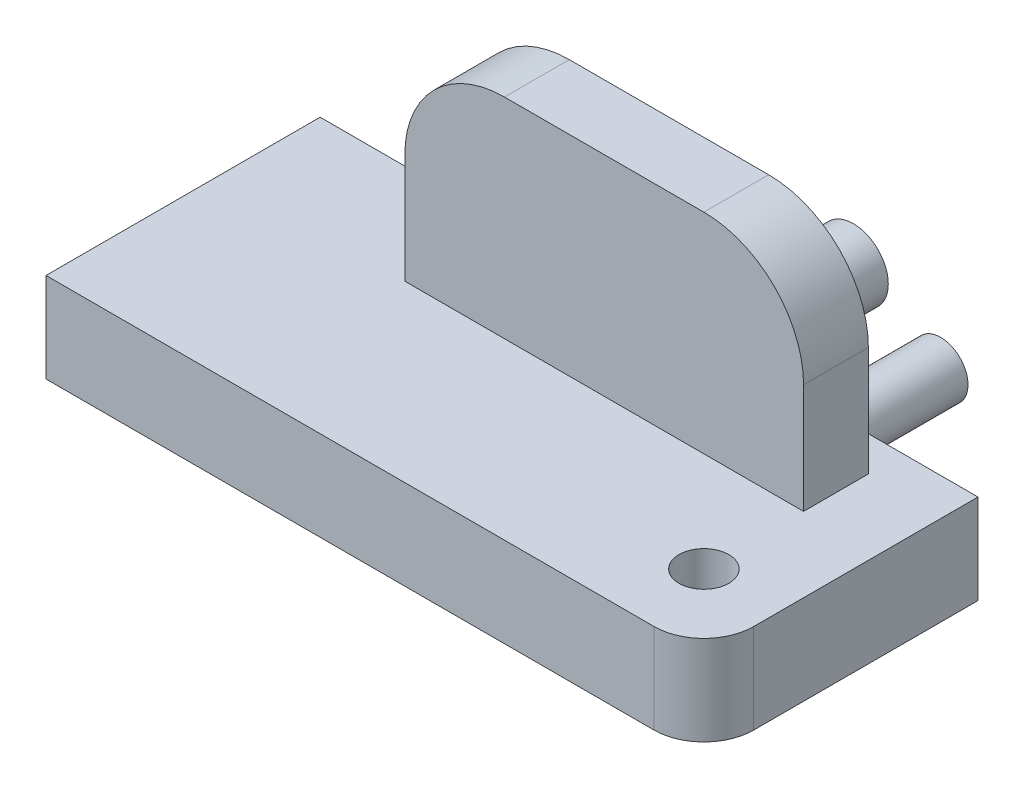
from build123d import *

# Parameters (mm, degrees)
BOSS_EXTRUDE2_DEPTH      = 8
BOSS_EXTRUDE2_DEPTH_BACK = 1
SKETCH1_R                = 2.5
CUT_EXTRUDE1_START       = -18
SKETCH2_R                = 2.5
CUT_EXTRUDE1_DEPTH       = 18
SKETCH3_R                = 2.75
BOSS_EXTRUDE3_DEPTH      = 13.75
SKETCH4_W                = 9
SKETCH4_H                = 6.5
BOSS_EXTRUDE4_DEPTH      = 15
BOSS_EXTRUDE5_DEPTH      = 8.5
SKETCH8_W                = 9
SKETCH8_H                = 6.5
BOSS_EXTRUDE6_DEPTH      = 6
SKETCH9_W                = 15.5
SKETCH9_H                = 6.5
BOSS_EXTRUDE7_DEPTH      = 21
SKETCH10_R               = 3.5
BOSS_EXTRUDE8_DEPTH      = 8.5
CUT_EXTRUDE2_START       = -8.5
SKETCH12_R               = 3.5
CUT_EXTRUDE2_DEPTH       = 8.5
FILLET1_R                = 10
BOSS_EXTRUDE9_DEPTH      = 11
BOSS_EXTRUDE9_DEPTH_BACK = 10
SKETCH13_W               = 27.5
SKETCH13_H               = 9


with BuildPart() as part:
    # Sketch1 → Boss-Extrude2 (new, two sides: drawn at the far end of the back side and taken through both)
    with BuildSketch(Plane(origin=(0, 0, 0), x_dir=(1, 0, 0), z_dir=(0, 1, 0)).offset(-BOSS_EXTRUDE2_DEPTH_BACK)):
        with BuildLine():
            Line((5, 0), (50, 0))
            ThreePointArc((50, 0), (53.535533906, 1.464466094), (55, 5))
            Line((55, 5), (55, 50))
            ThreePointArc((55, 50), (53.535533906, 53.535533906), (50, 55))
            Line((50, 55), (5, 55))
            ThreePointArc((5, 55), (1.464466094, 53.535533906), (0, 50))
            Line((0, 50), (0, 5))
            ThreePointArc((0, 5), (1.464466094, 1.464466094), (5, 0))
        make_face()
        with Locations((7.5, 47.5)):
            Circle(SKETCH1_R, mode=Mode.SUBTRACT)
        with Locations((47.5, 47.5)):
            Circle(SKETCH1_R, mode=Mode.SUBTRACT)
        with Locations((47.5, 7.5)):
            Circle(SKETCH1_R, mode=Mode.SUBTRACT)
        with Locations((7.5, 7.5)):
            Circle(SKETCH1_R, mode=Mode.SUBTRACT)
    extrude(amount=BOSS_EXTRUDE2_DEPTH + BOSS_EXTRUDE2_DEPTH_BACK)

    # Sketch2 → Cut-Extrude1 (cut)
    with BuildSketch(Plane(origin=(0, 8, 0), x_dir=(1, 0, 0), z_dir=(0, 1, 0)).offset(CUT_EXTRUDE1_START)):
        with BuildLine():
            Line((0, 50), (0, 27.5))
            Line((0, 27.5), (55, 27.5))
            Line((55, 27.5), (55, 50))
            ThreePointArc((55, 50), (53.535533906, 53.535533906), (50, 55))
            Line((50, 55), (5, 55))
            ThreePointArc((5, 55), (1.464466094, 53.535533906), (0, 50))
        make_face()
        with Locations((7.5, 47.5)):
            Circle(SKETCH2_R, mode=Mode.SUBTRACT)
        with Locations((47.5, 47.5)):
            Circle(SKETCH2_R, mode=Mode.SUBTRACT)
    extrude(amount=CUT_EXTRUDE1_DEPTH, mode=Mode.SUBTRACT)

    # Sketch3 → Boss-Extrude3 (add)
    with BuildSketch(Plane(origin=(0, 0, -27.5), x_dir=(-1, 0, 0), z_dir=(0, 0, -1))):
        with Locations((-37.5, 3.5)):
            Circle(SKETCH3_R)
        with Locations((-17.5, 3.5)):
            Circle(SKETCH3_R)
    extrude(amount=BOSS_EXTRUDE3_DEPTH)

    # Sketch4 → Boss-Extrude4 (add)
    with BuildSketch(Plane(origin=(0, 8, 0), x_dir=(1, 0, 0), z_dir=(0, 1, 0))):
        with Locations((27.5, 20.75)):
            Rectangle(SKETCH4_W, SKETCH4_H)
    extrude(amount=BOSS_EXTRUDE4_DEPTH)

    # Sketch5 → Boss-Extrude5 (add)
    with BuildSketch(Plane(origin=(0, 0, -24), x_dir=(-1, 0, 0), z_dir=(0, 0, -1))):
        with BuildLine():
            ThreePointArc((-25.636419782, 13.037388184), (-24.436298745, 14.307742745), (-24, 16))
            ThreePointArc((-24, 16), (-29.974873734, 18.474873734), (-27.5, 12.5))
            ThreePointArc((-27.5, 12.5), (-26.685966178, 12.595980474), (-25.916578842, 12.878657751))
            ThreePointArc((-25.916578842, 12.878657751), (-25.85405917, 13.094916041), (-25.636419782, 13.037388184))
        make_face()
    extrude(amount=BOSS_EXTRUDE5_DEPTH)

    # Sketch8 → Boss-Extrude6 (add)
    with BuildSketch(Plane(origin=(0, 23, 0), x_dir=(1, 0, 0), z_dir=(0, 1, 0))):
        with Locations((27.5, 20.75)):
            Rectangle(SKETCH8_W, SKETCH8_H)
    extrude(amount=BOSS_EXTRUDE6_DEPTH)

    # Sketch9 → Boss-Extrude7 (add)
    with BuildSketch(Plane(origin=(0, 8, 0), x_dir=(1, 0, 0), z_dir=(0, 1, 0))):
        with Locations((39.75, 20.75)):
            Rectangle(SKETCH9_W, SKETCH9_H)
        with Locations((15.25, 20.75)):
            Rectangle(SKETCH9_W, SKETCH9_H)
    extrude(amount=BOSS_EXTRUDE7_DEPTH)

    # Sketch10 → Boss-Extrude8 (add)
    with BuildSketch(Plane(origin=(0, 0, -24), x_dir=(-1, 0, 0), z_dir=(0, 0, -1))):
        with Locations((-17.5, 17)):
            Circle(SKETCH10_R)
        with Locations((-37.5, 17)):
            Circle(SKETCH10_R)
    extrude(amount=BOSS_EXTRUDE8_DEPTH)

    # Sketch12 → Cut-Extrude2 (cut)
    with BuildSketch(Plane(origin=(0, 0, -32.5), x_dir=(-1, 0, 0), z_dir=(0, 0, -1)).offset(CUT_EXTRUDE2_START)):
        with Locations((-27.5, 16)):
            Circle(SKETCH12_R)
    extrude(amount=CUT_EXTRUDE2_DEPTH, mode=Mode.SUBTRACT)

    # Fillet1
    fillet1_edges = [part.edges().sort_by_distance(p)[0] for p in [
        (47.5, 29, -20.75),
        (7.5, 29, -20.75),
    ]]
    fillet(fillet1_edges, radius=FILLET1_R)

    # Sketch13 → Boss-Extrude9 (add, two sides: drawn at the far end of the back side and taken through both)
    with BuildSketch(Plane.ZY.offset(-BOSS_EXTRUDE9_DEPTH_BACK)):
        with Locations((-13.75, 3.5)):
            Rectangle(SKETCH13_W, SKETCH13_H)
    extrude(amount=BOSS_EXTRUDE9_DEPTH + BOSS_EXTRUDE9_DEPTH_BACK)


solid = part.part
